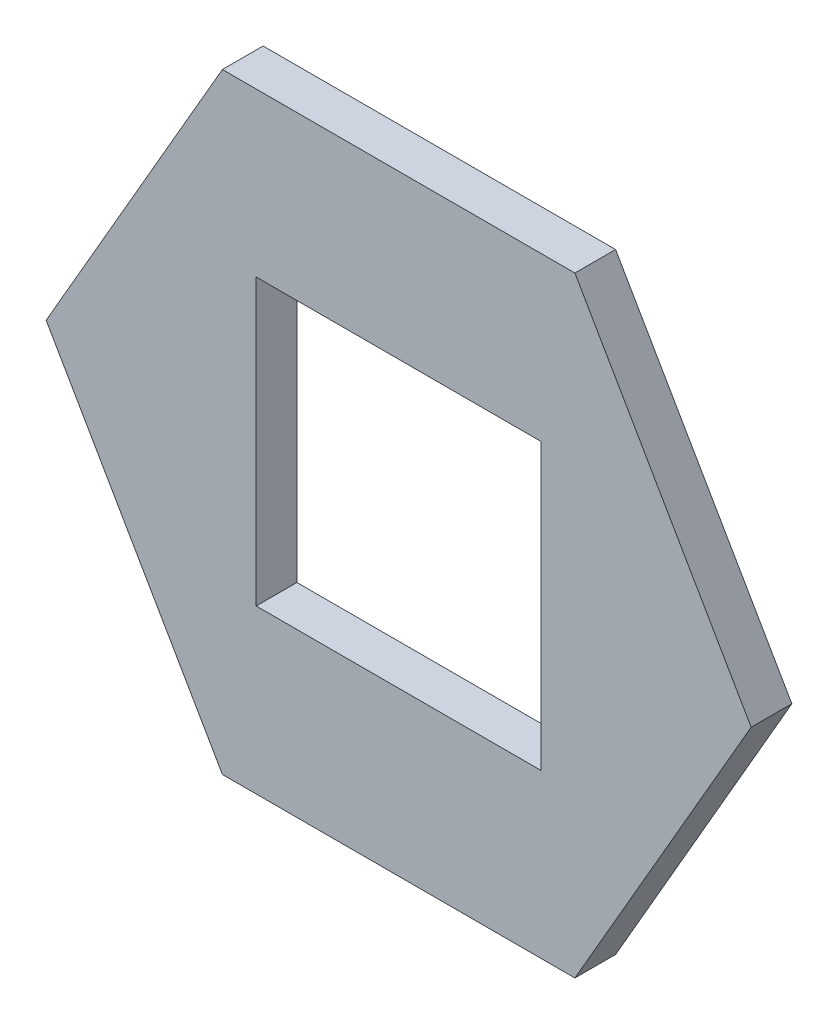
from build123d import *

# Parameters (mm, degrees)
CAP_DEPTH            = 10
SKETCH2_W            = 70
SKETCH2_H            = 70
BATTERY_ACCESS_DEPTH = 116


with BuildPart() as part:
    # Sketch1 → Cap (new body)
    with BuildSketch(Plane.XY):
        Polygon((86.602540378, 0), (43.301270189, 75), (-43.301270189, 75), (-86.602540378, 0), (-43.301270189, -75), (43.301270189, -75), align=None)
    extrude(amount=CAP_DEPTH)

    # Sketch2 → Battery Access (cut, through all)
    with BuildSketch(Plane.XY.offset(10)):
        Rectangle(SKETCH2_W, SKETCH2_H)
    extrude(amount=-BATTERY_ACCESS_DEPTH, mode=Mode.SUBTRACT)


solid = part.part
